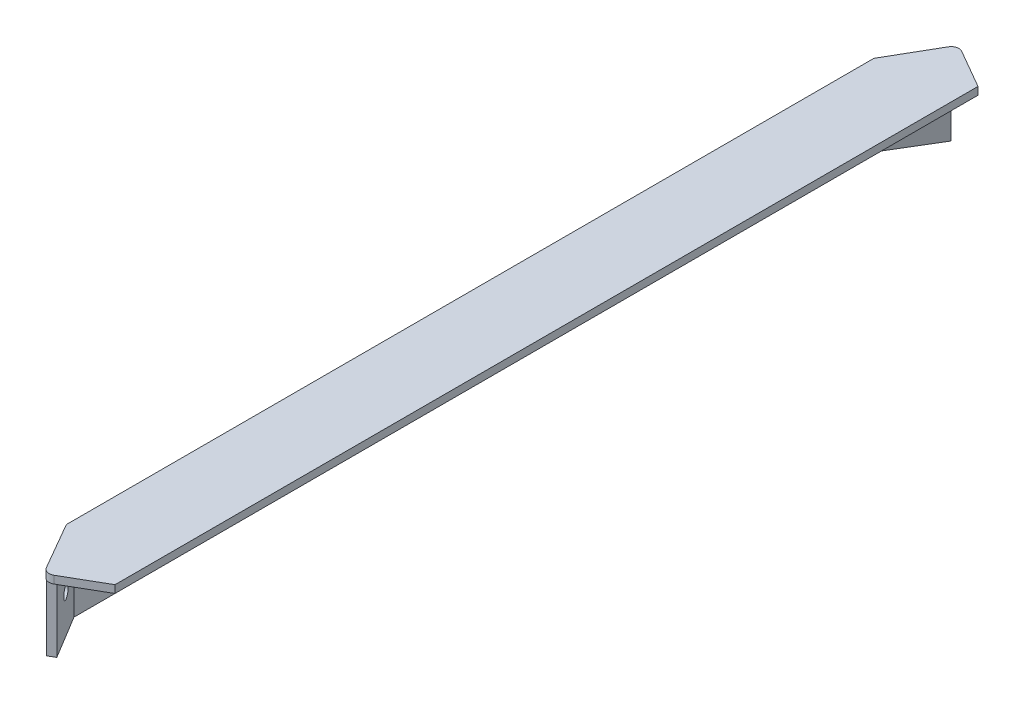
from build123d import *

# Parameters (mm, degrees)
BOSS_EXTRUDE1_DEPTH = 370
BOSS_EXTRUDE2_DEPTH = 63
BOSS_EXTRUDE4_DEPTH = 7
SKETCH10_R          = 6
CUT_EXTRUDE3_DEPTH  = 7
FILLET5_R           = 5


with BuildPart() as part:
    # Sketch1 → Boss-Extrude1 (new body)
    with BuildSketch(Plane.XY):
        Polygon((0, 0), (0, 70), (70, 70), (70, 63), (7, 63), (7, 0), align=None)
    extrude(amount=BOSS_EXTRUDE1_DEPTH)

    # Sketch2 → Boss-Extrude2 (add)
    with BuildSketch(Plane(origin=(0, 0, 0), x_dir=(1, 0, 0), z_dir=(0, 1, 0))):
        Polygon((0, -370), (25, -413.301270189), (31.062177826, -409.801270189), (7, -370), align=None)
    extrude(amount=BOSS_EXTRUDE2_DEPTH)

    # Sketch9 → Boss-Extrude4 (add)
    with BuildSketch(Plane(origin=(0, 63, 0), x_dir=(1, 0, 0), z_dir=(0, 1, 0))):
        with BuildLine():
            Line((0, -370), (25, -413.301270189))
            ThreePointArc((25, -413.301270189), (29.250444511, -416.562750973), (34.562177826, -415.863448016))
            Line((34.562177826, -415.863448016), (70, -395.403411844))
            Line((70, -395.403411844), (70, -370))
            Line((70, -370), (0, -370))
        make_face()
    extrude(amount=BOSS_EXTRUDE4_DEPTH)

    # Sketch10 → Cut-Extrude3 (cut)
    with BuildSketch(Plane(origin=(-158.687655898, 0, 95.935897948), x_dir=(-0.5173609804017633, 0, -0.8557672674026079), z_dir=(0.8557672674026079, 0, -0.5173609804017633))):
        with Locations((-341.764871942, 35)):
            Circle(SKETCH10_R)
    extrude(amount=-CUT_EXTRUDE3_DEPTH, mode=Mode.SUBTRACT)

    # Fillet5
    fillet5_edges = [part.edges().sort_by_distance(p)[0] for p in [
        (7, 63, 185),
        (19.031088913, 63, 389.900635095),
    ]]
    fillet(fillet5_edges, radius=FILLET5_R)

    # Mirror6: part across plane


with BuildPart() as part_1:
    add(part.part)
    add(part.part.mirror(Plane.XY))


solid = part_1.part
